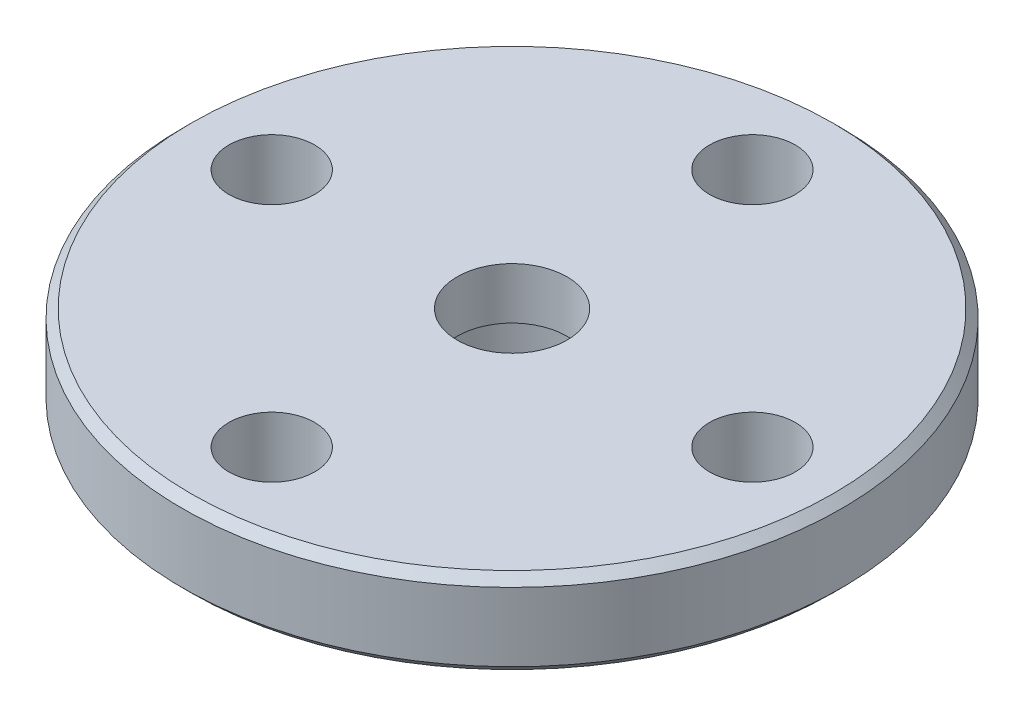
from build123d import *

# Parameters (mm, degrees)
SKETCH2_R          = 1.25
CUT_EXTRUDE1_DEPTH = 15.302796929


with BuildPart() as part:
    # Sketch1 → Revolve1 (revolve)
    with BuildSketch(Plane.XY, mode=Mode.PRIVATE) as revolve1_sk:
        Polygon((1.6, 3), (1.6, 4.5), (9.35, 4.5), (9.6, 4.25), (9.6, 2.25), (9.35, 2), (5.3, 2), (5.3, 0.25), (5.05, 0), (2.6, 0), (2.6, 3), align=None)
    revolve(revolve1_sk.sketch.rotate(Axis((0, 0, 0), (0, 1, 0)), 90), axis=Axis((0, 0, 0), (0, 1, 0)))

    # Sketch2 → Cut-Extrude1 (cut, through all)
    with BuildSketch(Plane(origin=(0, 0, 0), x_dir=(1, 0, 0), z_dir=(0, 1, 0))):
        with Locations(Location((0, 7, 0), (0, 0, 90))):
            Circle(SKETCH2_R)
        with Locations(Location((0, -7, 0), (0, 0, 90))):
            Circle(SKETCH2_R)
        with Locations(Location((7, 0, 0), (0, 0, 90))):
            Circle(SKETCH2_R)
        with Locations(Location((-7, 0, 0), (0, 0, 90))):
            Circle(SKETCH2_R)
    extrude(amount=CUT_EXTRUDE1_DEPTH, mode=Mode.SUBTRACT)


solid = part.part
